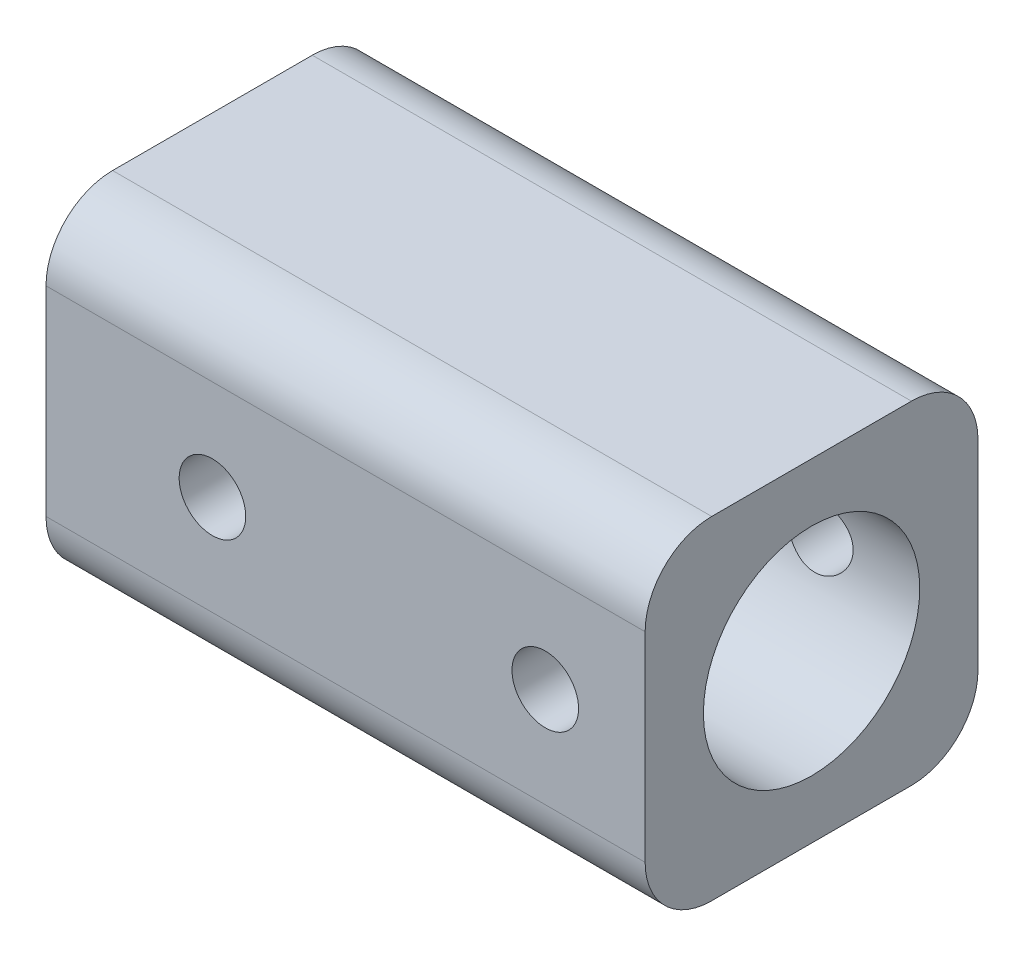
from build123d import *

# Parameters (mm, degrees)
SKETCH_1_W          = 10
SKETCH_1_H          = 10
EXTRUDE_2_DEPTH     = 18
SKETCH_2_R          = 3.25
CUT_EXTRUDE_1_DEPTH = 9
SKETCH_3_R          = 3
CUT_EXTRUDE_2_DEPTH = 15
SKETCH_4_R          = 1
CUT_EXTRUDE_3_DEPTH = 10
FILLET_1_R          = 2


with BuildPart() as part:
    # 草图1 → 凸台-拉伸2 (new body)
    with BuildSketch(Plane(origin=(0, 0, 0), x_dir=(0, 0, -1), z_dir=(1, 0, 0))):
        with Locations((-5, 5)):
            Rectangle(SKETCH_1_W, SKETCH_1_H)
    extrude(amount=EXTRUDE_2_DEPTH)

    # 草图2 → 切除-拉伸1 (cut)
    with BuildSketch(Plane(origin=(18, 0, 0), x_dir=(0, 0, -1), z_dir=(1, 0, 0))):
        with Locations((-5, 5)):
            Circle(SKETCH_2_R)
    extrude(amount=-CUT_EXTRUDE_1_DEPTH, mode=Mode.SUBTRACT)

    # 草图3 → 切除-拉伸2 (cut)
    with BuildSketch(Plane.ZY):
        with Locations((5, 5)):
            Circle(SKETCH_3_R)
    extrude(amount=-CUT_EXTRUDE_2_DEPTH, mode=Mode.SUBTRACT)

    # 草图4 → 切除-拉伸3 (cut)
    with BuildSketch(Plane(origin=(0, 0, 0), x_dir=(-1, 0, 0), z_dir=(0, 0, -1))):
        with Locations(Location((-15, 5, 0), (0, 0, 90))):
            Circle(SKETCH_4_R)
        with Locations(Location((-5, 5, 0), (0, 0, 90))):
            Circle(SKETCH_4_R)
    extrude(amount=-CUT_EXTRUDE_3_DEPTH, mode=Mode.SUBTRACT)

    # 圆角1
    fillet_1_edges = [part.edges().sort_by_distance(p)[0] for p in [
        (9, 0, 0),
        (9, 10, 0),
        (9, 10, 10),
        (9, 0, 10),
    ]]
    fillet(fillet_1_edges, radius=FILLET_1_R)


solid = part.part
